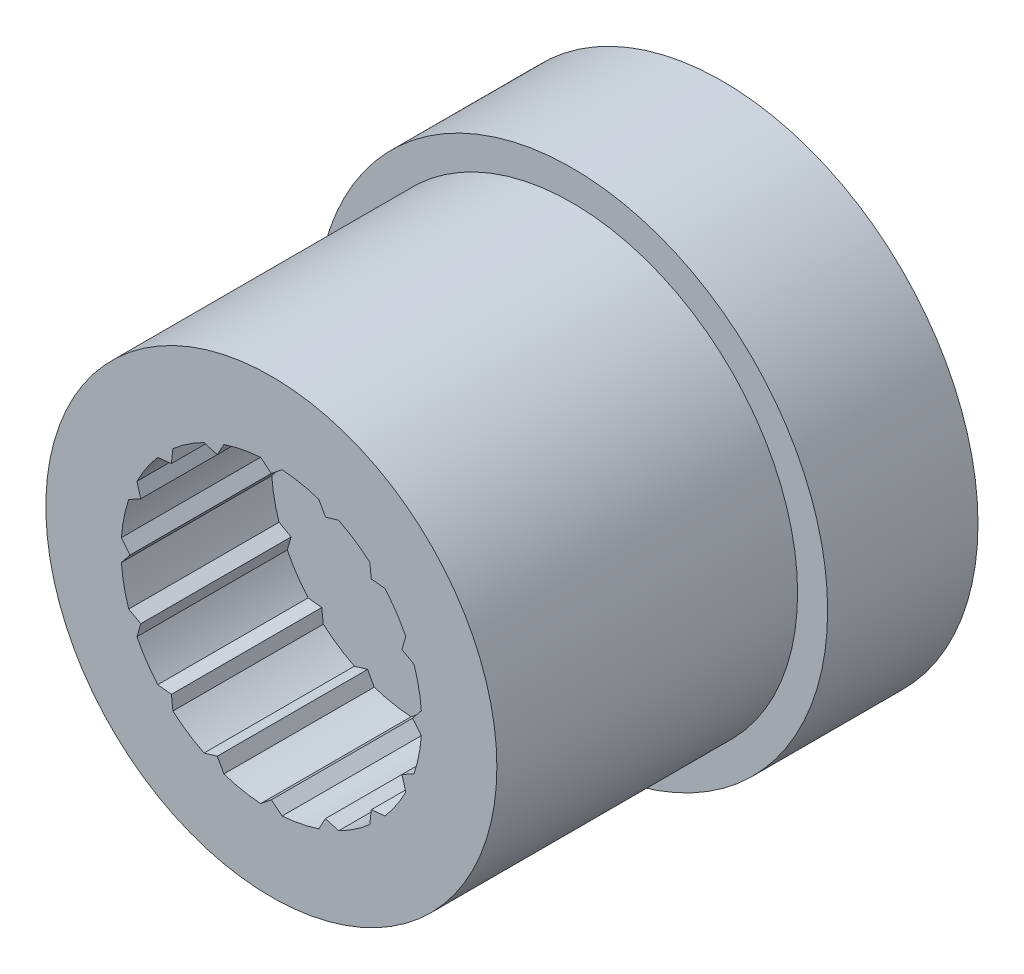
from build123d import *

# Parameters (mm, degrees)
SKETCH1_R           = 8.5
BOSS_EXTRUDE1_DEPTH = 5
SKETCH2_R           = 7.5
BOSS_EXTRUDE2_DEPTH = 10
SKETCH3_R           = 5
CUT_EXTRUDE1_DEPTH  = 5
BOSS_EXTRUDE5_DEPTH = 5
SKETCH5_R           = 6.270829758
SKETCH5_R_2         = 2.95954522
CUT_EXTRUDE2_DEPTH  = 1


with BuildPart() as part:
    # Sketch1 → Boss-Extrude1 (new body)
    with BuildSketch(Plane.XY):
        Circle(SKETCH1_R)
    extrude(amount=BOSS_EXTRUDE1_DEPTH)

    # Sketch2 → Boss-Extrude2 (add)
    with BuildSketch(Plane.XY.offset(5)):
        Circle(SKETCH2_R)
    extrude(amount=BOSS_EXTRUDE2_DEPTH)

    # Sketch3 → Cut-Extrude1 (cut)
    with BuildSketch(Plane.XY.offset(15)):
        Circle(SKETCH3_R)
    extrude(amount=-CUT_EXTRUDE1_DEPTH, mode=Mode.SUBTRACT)

    # Sketch4 → Boss-Extrude5 (add)
    with BuildSketch(Plane.XY.offset(15)):
        Polygon((-4.7, 0), (-5.302722063, 0.75), (-5.302722063, -0.75), align=None)
        Polygon((-4.612063806, 2.722173529), (-5.186088955, 1.336354231), (-4.342233803, 1.798612132), align=None)
        Polygon((-3.219260644, 4.279920815), (-4.279920815, 3.219260644), (-3.323401872, 3.323401872), align=None)
        Polygon((-1.336354231, 5.186088955), (-2.722173529, 4.612063806), (-1.798612132, 4.342233803), align=None)
        Polygon((0.75, 5.302722063), (-0.75, 5.302722063), (0, 4.7), align=None)
        Polygon((2.722173529, 4.612063806), (1.336354231, 5.186088955), (1.798612132, 4.342233803), align=None)
        Polygon((4.279920815, 3.219260644), (3.219260644, 4.279920815), (3.323401872, 3.323401872), align=None)
        Polygon((5.186088955, 1.336354231), (4.612063806, 2.722173529), (4.342233803, 1.798612132), align=None)
        Polygon((5.302722063, -0.75), (5.302722063, 0.75), (4.7, 0), align=None)
        Polygon((4.612063806, -2.722173529), (5.186088955, -1.336354231), (4.342233803, -1.798612132), align=None)
        Polygon((3.219260644, -4.279920815), (4.279920815, -3.219260644), (3.323401872, -3.323401872), align=None)
        Polygon((1.336354231, -5.186088955), (2.722173529, -4.612063806), (1.798612132, -4.342233803), align=None)
        Polygon((-0.75, -5.302722063), (0.75, -5.302722063), (0, -4.7), align=None)
        Polygon((-2.722173529, -4.612063806), (-1.336354231, -5.186088955), (-1.798612132, -4.342233803), align=None)
        Polygon((-4.279920815, -3.219260644), (-3.219260644, -4.279920815), (-3.323401872, -3.323401872), align=None)
        Polygon((-5.186088955, -1.336354231), (-4.612063806, -2.722173529), (-4.342233803, -1.798612132), align=None)
    extrude(amount=-BOSS_EXTRUDE5_DEPTH)

    # Sketch5 → Cut-Extrude2 (cut)
    with BuildSketch(Plane(origin=(0, 0, 0), x_dir=(-1, 0, 0), z_dir=(0, 0, -1))):
        Circle(SKETCH5_R)
        Circle(SKETCH5_R_2, mode=Mode.SUBTRACT)
    extrude(amount=-CUT_EXTRUDE2_DEPTH, mode=Mode.SUBTRACT)


solid = part.part
